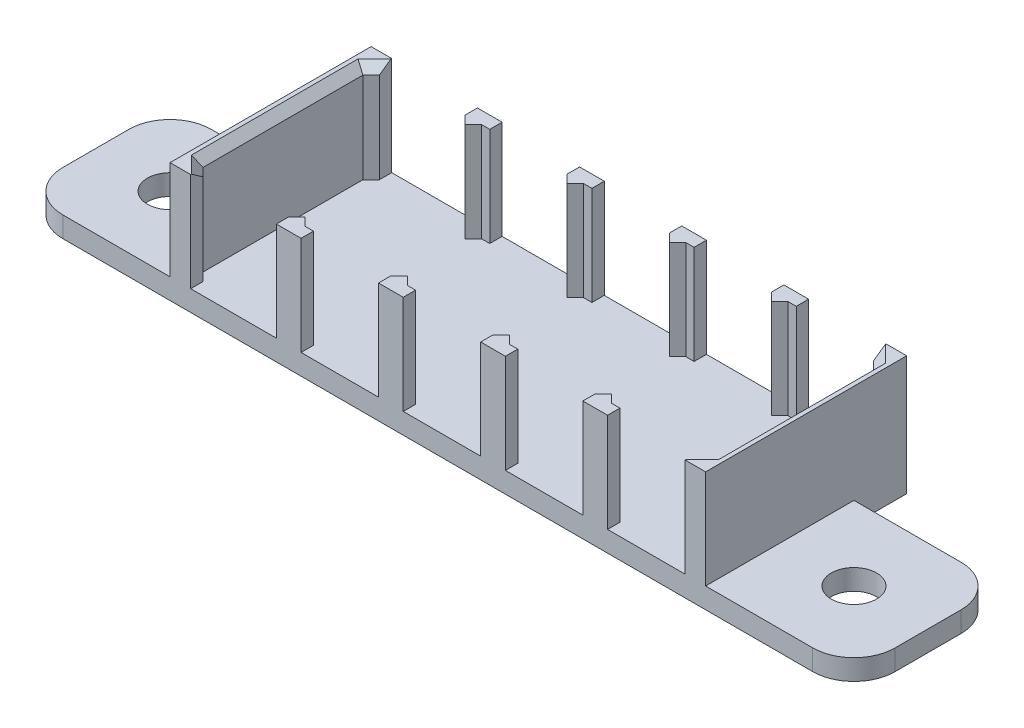
from build123d import *

# Parameters (mm, degrees)
SKETCH_1_W                    = 65
SKETCH_1_H                    = 24.4
EXTRUDE_1_DEPTH               = 2.5
SKETCH_2_R                    = 2.75
EXTRUDE_2_DEPTH               = 2.5
EXTRUDE_3_DEPTH               = 12
CHAMFER_1_SIZE                = 1
EXTRUDE_4_DEPTH               = 12
PATTERN_LINEAR_1_COUNT        = 4
PATTERN_LINEAR_1_PITCH        = 12.4
PATTERN_LINEAR_1_COPY_1_DEPTH = 12
PATTERN_LINEAR_1_COPY_2_DEPTH = 12
PATTERN_LINEAR_1_COPY_3_DEPTH = 12


with BuildPart() as part:
    # Эскиз1 → Бобышка-Вытянуть1 (new body)
    with BuildSketch(Plane(origin=(0, 0, 0), x_dir=(1, 0, 0), z_dir=(0, 1, 0))):
        with Locations((0, 2.228571429)):
            Rectangle(SKETCH_1_W, SKETCH_1_H)
    extrude(amount=EXTRUDE_1_DEPTH)

    # Эскиз2 → Бобышка-Вытянуть2 (add)
    with BuildSketch(Plane(origin=(0, 0, 0), x_dir=(1, 0, 0), z_dir=(0, 1, 0))):
        with BuildLine():
            Line((-32.5, -9.971428571), (-45.5, -9.971428571))
            ThreePointArc((-45.5, -9.971428571), (-49.035533906, -8.506962477), (-50.5, -4.971428571))
            Line((-50.5, -4.971428571), (-50.5, 3.028571429))
            ThreePointArc((-50.5, 3.028571429), (-49.035533906, 6.564105335), (-45.5, 8.028571429))
            Line((-45.5, 8.028571429), (-32.5, 8.028571429))
            Line((-32.5, 8.028571429), (-32.5, -9.971428571))
        make_face()
        with Locations(Location((-41.5, -0.971428571, 0), (0, 0, 270))):
            Circle(SKETCH_2_R, mode=Mode.SUBTRACT)
    extrude_2 = extrude(amount=EXTRUDE_2_DEPTH)

    # Зеркальное отражение1: Бобышка-Вытянуть2 across plane
    add(extrude_2.mirror(Plane(origin=(0, 0, 0), x_dir=(0, 0, 1), z_dir=(1, 0, 0))))

    # Эскиз3 → Бобышка-Вытянуть3 (add)
    with BuildSketch(Plane(origin=(0, 2.5, 0), x_dir=(1, 0, 0), z_dir=(0, 1, 0))):
        Polygon((-32.5, 14.428571429), (-31, 14.428571429), (-30, 14.428571429), (-30, 12.928571429), (-31, 11.928571429), (-31, -7.471428571), (-30, -8.471428571), (-30, -9.971428571), (-31, -9.971428571), (-32.5, -9.971428571), align=None)
    extrude_3 = extrude(amount=EXTRUDE_3_DEPTH)

    # Зеркальное отражение2: Бобышка-Вытянуть3 across plane
    add(extrude_3.mirror(Plane(origin=(0, 0, 0), x_dir=(0, 0, 1), z_dir=(1, 0, 0))))

    # Фаска1
    chamfer_1_edges = [part.edges().sort_by_distance(p)[0] for p in [
        (-30.5, 14.5, 7.971428571),
        (-31, 14.5, -2.228571429),
        (-30.5, 14.5, -12.428571429),
        (30.5, 14.5, -12.428571429),
        (31, 14.5, -2.228571429),
        (30.5, 14.5, 7.971428571),
    ]]
    chamfer(chamfer_1_edges, length=CHAMFER_1_SIZE)

    # Эскиз4 → Бобышка-Вытянуть4 (add)
    with BuildSketch(Plane(origin=(0, 2.5, 0), x_dir=(1, 0, 0), z_dir=(0, 1, 0))):
        Polygon((-18.6, -9.971428571), (-19.6, -9.971428571), (-19.6, -8.471428571), (-18.6, -7.471428571), (-17.6, -8.471428571), (-16.6, -8.471428571), (-16.6, -9.971428571), align=None)
    extrude_4 = extrude(amount=EXTRUDE_4_DEPTH)

    # Зеркальное отражение3: Бобышка-Вытянуть4 across plane
    add(extrude_4.mirror(Plane.XY.offset(-2.228571429)))

    # Линейный массив1: Бобышка-Вытянуть4 ×4
    with Locations(*[(i * PATTERN_LINEAR_1_PITCH, 0, 0) for i in range(1, PATTERN_LINEAR_1_COUNT)]):
        add(extrude_4)

    # Линейный массив1 copy 1 sketch → Линейный массив1 copy 1 (add)
    with BuildSketch(Plane(origin=(12.4, 2.5, -4.457142857), x_dir=(1, 0, 0), z_dir=(0, 1, 0))):
        Polygon((-18.6, 9.971428571), (-19.6, 9.971428571), (-19.6, 8.471428571), (-18.6, 7.471428571), (-17.6, 8.471428571), (-16.6, 8.471428571), (-16.6, 9.971428571), align=None)
    extrude(amount=PATTERN_LINEAR_1_COPY_1_DEPTH)

    # Линейный массив1 copy 2 sketch → Линейный массив1 copy 2 (add)
    with BuildSketch(Plane(origin=(24.8, 2.5, -4.457142857), x_dir=(1, 0, 0), z_dir=(0, 1, 0))):
        Polygon((-18.6, 9.971428571), (-19.6, 9.971428571), (-19.6, 8.471428571), (-18.6, 7.471428571), (-17.6, 8.471428571), (-16.6, 8.471428571), (-16.6, 9.971428571), align=None)
    extrude(amount=PATTERN_LINEAR_1_COPY_2_DEPTH)

    # Линейный массив1 copy 3 sketch → Линейный массив1 copy 3 (add)
    with BuildSketch(Plane(origin=(37.2, 2.5, -4.457142857), x_dir=(1, 0, 0), z_dir=(0, 1, 0))):
        Polygon((-18.6, 9.971428571), (-19.6, 9.971428571), (-19.6, 8.471428571), (-18.6, 7.471428571), (-17.6, 8.471428571), (-16.6, 8.471428571), (-16.6, 9.971428571), align=None)
    extrude(amount=PATTERN_LINEAR_1_COPY_3_DEPTH)


solid = part.part
